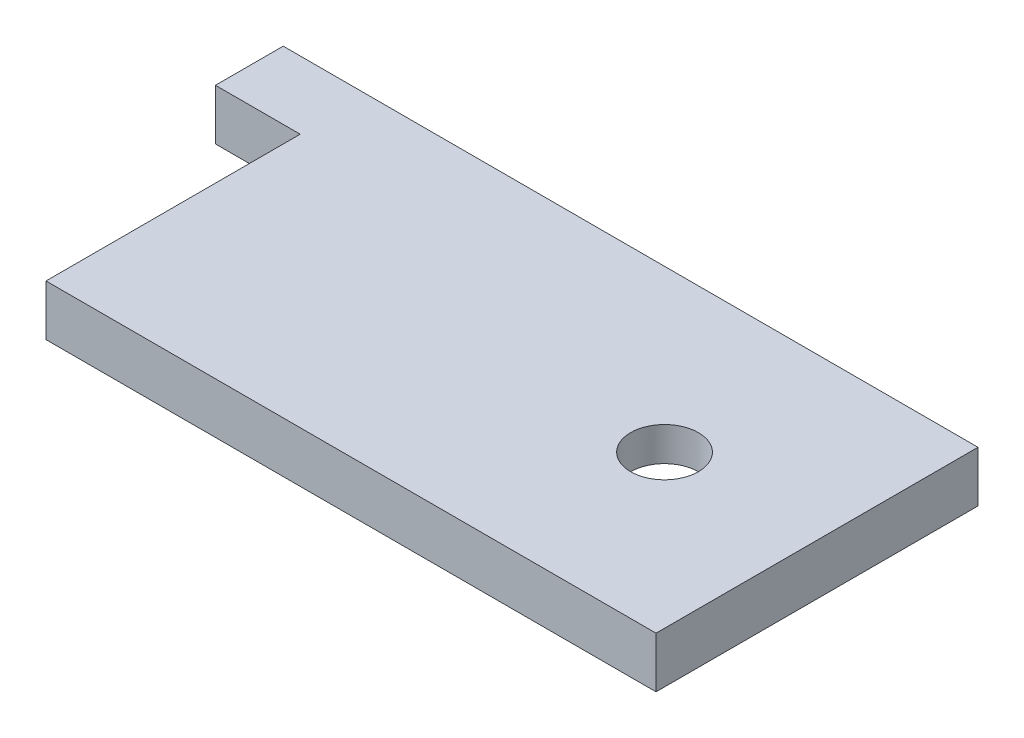
from build123d import *

# Parameters (mm, degrees)
P_IDAT_VYSUNUT_M1_DEPTH  = 19
SKICA2_W                 = 4
SKICA2_H                 = 4
ODEBRAT_VYSUNUT_M1_DEPTH = 15
SKICA3_W                 = 32
SKICA3_H                 = 15
ODEBRAT_VYSUNUT_M2_DEPTH = 1
SKICA4_W                 = 4
SKICA4_H                 = 4
ODEBRAT_VYSUNUT_M3_DEPTH = 50
SKICA5_W                 = 4
SKICA5_H                 = 3
P_IDAT_VYSUNUT_M2_DEPTH  = 5
SKICA6_R                 = 2
ODEBRAT_VYSUNUT_M4_DEPTH = 5


with BuildPart() as part:
    # Skica1 → Přidat vysunutím1 (new body)
    with BuildSketch(Plane.XY):
        Polygon((0, 0), (0, 7), (4, 7), (4, 3), (36, 3), (36, 0), align=None)
    extrude(amount=P_IDAT_VYSUNUT_M1_DEPTH)

    # Skica2 → Odebrat vysunutím1 (cut)
    with BuildSketch(Plane.XY.offset(19)):
        with Locations((2, 5)):
            Rectangle(SKICA2_W, SKICA2_H)
    extrude(amount=-ODEBRAT_VYSUNUT_M1_DEPTH, mode=Mode.SUBTRACT)

    # Skica3 → Odebrat vysunutím2 (cut)
    with BuildSketch(Plane.XZ):
        with Locations((18, 9.5)):
            Rectangle(SKICA3_W, SKICA3_H)
    extrude(amount=-ODEBRAT_VYSUNUT_M2_DEPTH, mode=Mode.SUBTRACT)

    # Skica4 → Odebrat vysunutím3 (cut)
    with BuildSketch(Plane.ZY):
        with Locations((2, 5)):
            Rectangle(SKICA4_W, SKICA4_H)
    extrude(amount=-ODEBRAT_VYSUNUT_M3_DEPTH, mode=Mode.SUBTRACT)

    # Skica5 → Přidat vysunutím2 (add)
    with BuildSketch(Plane.ZY):
        with Locations((2, 1.5)):
            Rectangle(SKICA5_W, SKICA5_H)
    extrude(amount=P_IDAT_VYSUNUT_M2_DEPTH)

    # Skica6 → Odebrat vysunutím4 (cut)
    with BuildSketch(Plane.XZ.offset(-1)):
        with Locations((27, 9.5)):
            Circle(SKICA6_R)
    extrude(amount=-ODEBRAT_VYSUNUT_M4_DEPTH, mode=Mode.SUBTRACT)


solid = part.part
